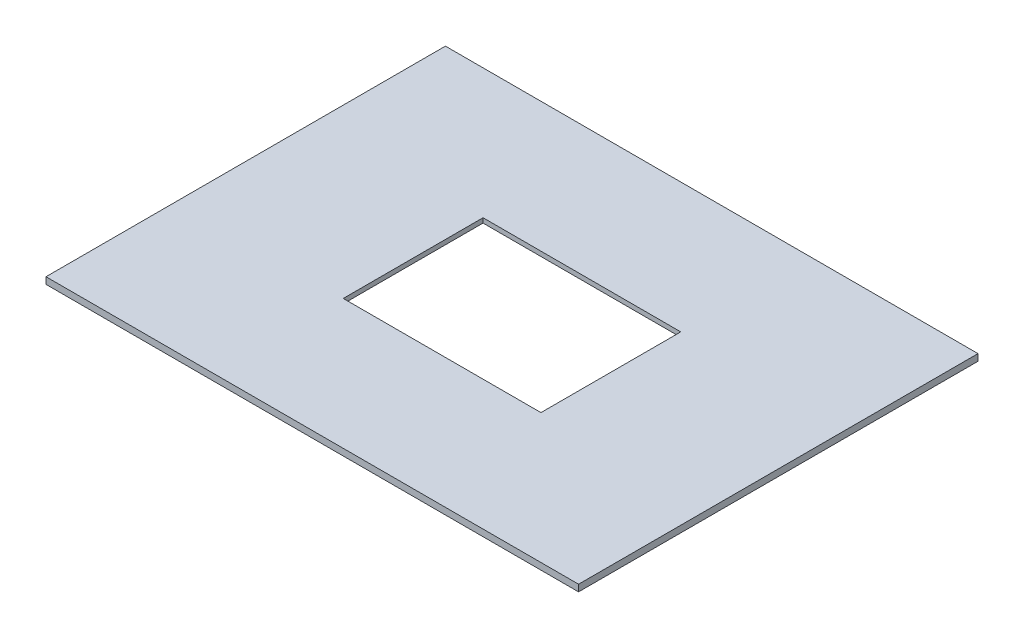
from build123d import *

# Parameters (mm, degrees)
SKETCH1_W      = 800
SKETCH1_H      = 600
SKETCH1_W_2    = 297
SKETCH1_H_2    = 210
EXTRUDE1_DEPTH = 10
EXTRUDE2_DEPTH = 3
SKETCH3_W      = 297
SKETCH3_H      = 5
EXTRUDE3_DEPTH = 3


with BuildPart() as part:
    # Sketch1 → Extrude1 (new body)
    with BuildSketch(Plane(origin=(0, 0, 0), x_dir=(1, 0, 0), z_dir=(0, 1, 0))):
        Rectangle(SKETCH1_W, SKETCH1_H)
        Rectangle(SKETCH1_W_2, SKETCH1_H_2, mode=Mode.SUBTRACT)
    extrude(amount=-EXTRUDE1_DEPTH)

    # Sketch2 → Extrude2 (cut)
    with BuildSketch(Plane.XZ.offset(10)):
        with BuildLine():
            Line((-148.5, -115), (-148.5, 115))
            ThreePointArc((-148.5, 115), (-151, 117.5), (-153.5, 115))
            Line((-153.5, 115), (-153.5, -115))
            ThreePointArc((-153.5, -115), (-151, -117.5), (-148.5, -115))
        make_face()
    extrude2 = extrude(amount=-EXTRUDE2_DEPTH, mode=Mode.SUBTRACT)

    # Mirror1: Extrude2 across plane
    add(extrude2.mirror(Plane(origin=(0, 0, 0), x_dir=(0, 0, 1), z_dir=(1, 0, 0))), mode=Mode.SUBTRACT)

    # Sketch3 → Extrude3 (cut)
    with BuildSketch(Plane.XZ.offset(10)):
        with Locations((0, 107.5)):
            Rectangle(SKETCH3_W, SKETCH3_H)
    extrude3 = extrude(amount=-EXTRUDE3_DEPTH, mode=Mode.SUBTRACT)

    # Mirror2: Extrude3 across plane
    add(extrude3.mirror(Plane.XY), mode=Mode.SUBTRACT)


solid = part.part
